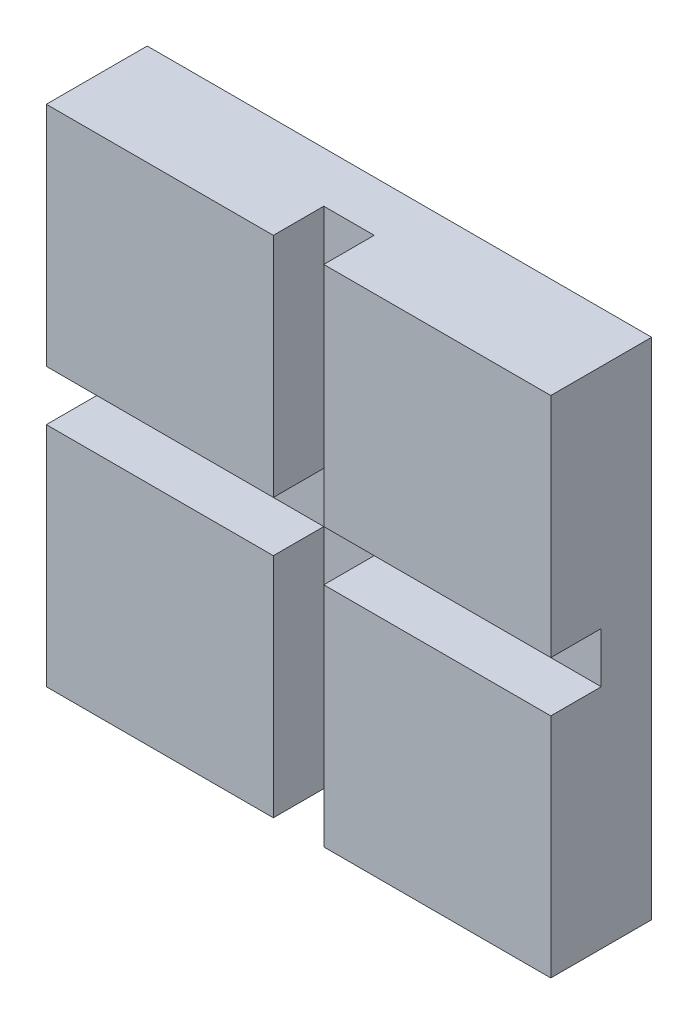
from build123d import *

# Parameters (mm, degrees)
SKETCH1_W      = 100
SKETCH1_H      = 100
EXTRUDE1_DEPTH = 20
SKETCH2_W      = 10
SKETCH2_H      = 100
EXTRUDE2_DEPTH = 10
SKETCH3_W      = 100
SKETCH3_H      = 10
EXTRUDE3_DEPTH = 10


with BuildPart() as part:
    # Sketch1 → Extrude1 (new body)
    with BuildSketch(Plane.XY):
        Rectangle(SKETCH1_W, SKETCH1_H)
    extrude(amount=-EXTRUDE1_DEPTH)

    # Sketch2 → Extrude2 (cut)
    with BuildSketch(Plane.XY):
        Rectangle(SKETCH2_W, SKETCH2_H)
    extrude(amount=-EXTRUDE2_DEPTH, mode=Mode.SUBTRACT)

    # Sketch3 → Extrude3 (cut)
    with BuildSketch(Plane.XY):
        Rectangle(SKETCH3_W, SKETCH3_H)
    extrude(amount=-EXTRUDE3_DEPTH, mode=Mode.SUBTRACT)


solid = part.part
